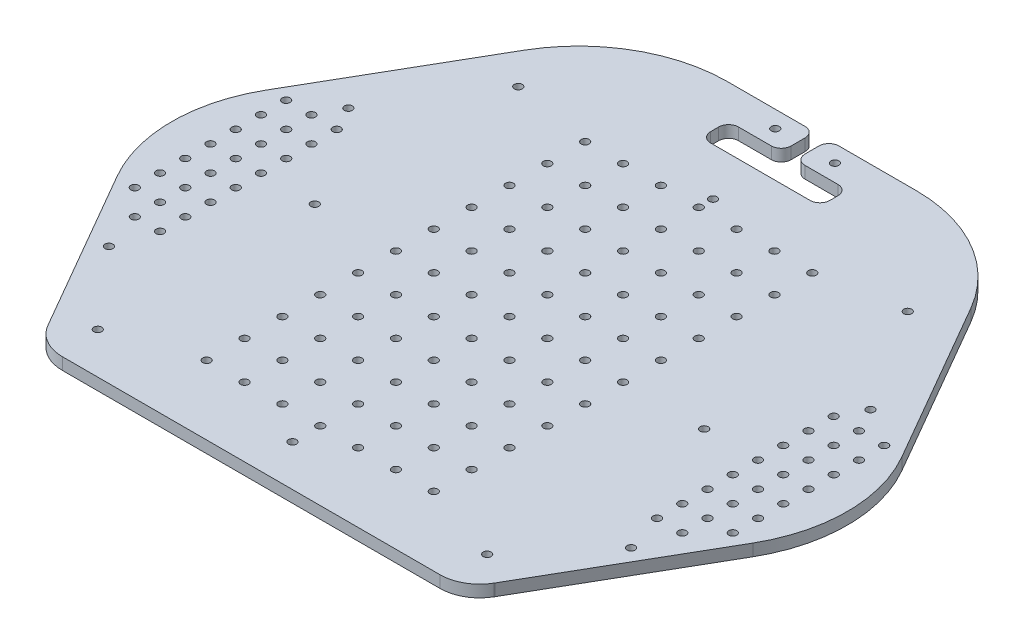
from build123d import *

# Parameters (mm, degrees)
ESBO_O1_R                = 2
RESSALTO_EXTRUS_O1_DEPTH = 6


with BuildPart() as part:
    # Esboço1 → Ressalto-extrusão1 (new body)
    with BuildSketch(Plane(origin=(0, 6, 0), x_dir=(1, 0, 0), z_dir=(0, 1, 0))):
        with BuildLine():
            Line((-94.999273038, -130), (94.999273038, -130))
            ThreePointArc((94.999273038, -130), (104.95780768, -127.344382024), (112.27173596, -120.082758778))
            ThreePointArc((112.27173596, -120.082758778), (112.362006236, -119.927693826), (112.451905284, -119.77241336))
            Line((112.451905284, -119.77241336), (159.951905284, -37.5))
            ThreePointArc((159.951905284, -37.5), (170, 0), (159.951905284, 37.5))
            Line((159.951905284, 37.5), (112.451905284, 119.77241336))
            ThreePointArc((112.451905284, 119.77241336), (85, 147.224318643), (47.5, 157.27241336))
            Line((47.5, 157.27241336), (8.5, 157.27241336))
            ThreePointArc((8.5, 157.27241336), (4.964466094, 155.807947265), (3.5, 152.27241336))
            Line((3.5, 152.27241336), (3.5, 145.27241336))
            ThreePointArc((3.5, 145.27241336), (4.964466094, 141.736879454), (8.5, 140.27241336))
            Line((8.5, 140.27241336), (25, 140.27241336))
            ThreePointArc((25, 140.27241336), (28.535533906, 138.807947265), (30, 135.27241336))
            Line((30, 135.27241336), (30, 131.27241336))
            ThreePointArc((30, 131.27241336), (28.535533906, 127.736879454), (25, 126.27241336))
            Line((25, 126.27241336), (-25, 126.27241336))
            ThreePointArc((-25, 126.27241336), (-28.535533906, 127.736879454), (-30, 131.27241336))
            Line((-30, 131.27241336), (-30, 135.27241336))
            ThreePointArc((-30, 135.27241336), (-28.535533906, 138.807947265), (-25, 140.27241336))
            Line((-25, 140.27241336), (-8.5, 140.27241336))
            ThreePointArc((-8.5, 140.27241336), (-4.964466094, 141.736879454), (-3.5, 145.27241336))
            Line((-3.5, 145.27241336), (-3.5, 152.27241336))
            ThreePointArc((-3.5, 152.27241336), (-4.964466094, 155.807947265), (-8.5, 157.27241336))
            Line((-8.5, 157.27241336), (-47.5, 157.27241336))
            ThreePointArc((-47.5, 157.27241336), (-85, 147.224318643), (-112.451905284, 119.77241336))
            Line((-112.451905284, 119.77241336), (-159.951905284, 37.5))
            ThreePointArc((-159.951905284, 37.5), (-170, 0), (-159.951905284, -37.5))
            Line((-159.951905284, -37.5), (-112.451905284, -119.77241336))
            ThreePointArc((-112.451905284, -119.77241336), (-112.362006236, -119.927693826), (-112.27173596, -120.082758778))
            ThreePointArc((-112.27173596, -120.082758778), (-104.95780768, -127.344382024), (-94.999273038, -130))
        make_face()
        with Locations(Location((150.5, -25.4, 0), (0, 0, 90))):
            Circle(ESBO_O1_R, mode=Mode.SUBTRACT)
        with Locations(Location((150.5, -12.7, 0), (0, 0, 90))):
            Circle(ESBO_O1_R, mode=Mode.SUBTRACT)
        with Locations(Location((150.5, 0, 0), (0, 0, 90))):
            Circle(ESBO_O1_R, mode=Mode.SUBTRACT)
        with Locations(Location((150.5, 12.7, 0), (0, 0, 90))):
            Circle(ESBO_O1_R, mode=Mode.SUBTRACT)
        with Locations(Location((150.5, 25.4, 0), (0, 0, 90))):
            Circle(ESBO_O1_R, mode=Mode.SUBTRACT)
        with Locations(Location((-150.5, -25.4, 0), (0, 0, 90))):
            Circle(ESBO_O1_R, mode=Mode.SUBTRACT)
        with Locations(Location((-150.5, -12.7, 0), (0, 0, 90))):
            Circle(ESBO_O1_R, mode=Mode.SUBTRACT)
        with Locations(Location((-150.5, 0, 0), (0, 0, 90))):
            Circle(ESBO_O1_R, mode=Mode.SUBTRACT)
        with Locations(Location((-150.5, 12.7, 0), (0, 0, 90))):
            Circle(ESBO_O1_R, mode=Mode.SUBTRACT)
        with Locations(Location((-150.5, 25.4, 0), (0, 0, 90))):
            Circle(ESBO_O1_R, mode=Mode.SUBTRACT)
        with Locations(Location((150.5, -38.1, 0), (0, 0, 90))):
            Circle(ESBO_O1_R, mode=Mode.SUBTRACT)
        with Locations(Location((150.5, 38.1, 0), (0, 0, 90))):
            Circle(ESBO_O1_R, mode=Mode.SUBTRACT)
        with Locations(Location((-150.5, -38.1, 0), (0, 0, 90))):
            Circle(ESBO_O1_R, mode=Mode.SUBTRACT)
        with Locations(Location((-150.5, 38.1, 0), (0, 0, 90))):
            Circle(ESBO_O1_R, mode=Mode.SUBTRACT)
        with Locations(Location((15, 148.77, 0), (0, 0, 90))):
            Circle(ESBO_O1_R, mode=Mode.SUBTRACT)
        with Locations(Location((-15, 148.77, 0), (0, 0, 90))):
            Circle(ESBO_O1_R, mode=Mode.SUBTRACT)
        with Locations(Location((131.4, -70.2, 0), (0, 0, 90))):
            Circle(ESBO_O1_R, mode=Mode.SUBTRACT)
        with Locations(Location((-131.4, -70.2, 0), (0, 0, 90))):
            Circle(ESBO_O1_R, mode=Mode.SUBTRACT)
        with Locations(Location((131.4, 50.3, 0), (0, 0, 90))):
            Circle(ESBO_O1_R, mode=Mode.SUBTRACT)
        with Locations(Location((-131.4, 50.3, 0), (0, 0, 90))):
            Circle(ESBO_O1_R, mode=Mode.SUBTRACT)
        with Locations(Location((98, -109.22, 0), (0, 0, 90))):
            Circle(ESBO_O1_R, mode=Mode.SUBTRACT)
        with Locations(Location((-125.0696, -50.8, 0), (0, 0, 90))):
            Circle(ESBO_O1_R, mode=Mode.SUBTRACT)
        with Locations(Location((-137.7696, -50.8, 0), (0, 0, 90))):
            Circle(ESBO_O1_R, mode=Mode.SUBTRACT)
        with Locations(Location((125.0696, -50.8, 0), (0, 0, 90))):
            Circle(ESBO_O1_R, mode=Mode.SUBTRACT)
        with Locations(Location((137.7696, -50.8, 0), (0, 0, 90))):
            Circle(ESBO_O1_R, mode=Mode.SUBTRACT)
        with Locations(Location((-137.7696, 12.7, 0), (0, 0, 90))):
            Circle(ESBO_O1_R, mode=Mode.SUBTRACT)
        with Locations(Location((-137.7696, 25.4, 0), (0, 0, 90))):
            Circle(ESBO_O1_R, mode=Mode.SUBTRACT)
        with Locations(Location((-137.7696, 38.1, 0), (0, 0, 90))):
            Circle(ESBO_O1_R, mode=Mode.SUBTRACT)
        with Locations(Location((-125.0696, 38.1, 0), (0, 0, 90))):
            Circle(ESBO_O1_R, mode=Mode.SUBTRACT)
        with Locations(Location((-125.0696, 25.4, 0), (0, 0, 90))):
            Circle(ESBO_O1_R, mode=Mode.SUBTRACT)
        with Locations(Location((-125.0696, 12.7, 0), (0, 0, 90))):
            Circle(ESBO_O1_R, mode=Mode.SUBTRACT)
        with Locations(Location((-137.7696, -12.7, 0), (0, 0, 90))):
            Circle(ESBO_O1_R, mode=Mode.SUBTRACT)
        with Locations(Location((-137.7696, -25.4, 0), (0, 0, 90))):
            Circle(ESBO_O1_R, mode=Mode.SUBTRACT)
        with Locations(Location((-137.7696, -38.1, 0), (0, 0, 90))):
            Circle(ESBO_O1_R, mode=Mode.SUBTRACT)
        with Locations(Location((-125.0696, -38.1, 0), (0, 0, 90))):
            Circle(ESBO_O1_R, mode=Mode.SUBTRACT)
        with Locations(Location((-125.0696, -25.4, 0), (0, 0, 90))):
            Circle(ESBO_O1_R, mode=Mode.SUBTRACT)
        with Locations(Location((-125.0696, -12.7, 0), (0, 0, 90))):
            Circle(ESBO_O1_R, mode=Mode.SUBTRACT)
        with Locations(Location((-137.7696, 0, 0), (0, 0, 90))):
            Circle(ESBO_O1_R, mode=Mode.SUBTRACT)
        with Locations(Location((-125.0696, 0, 0), (0, 0, 90))):
            Circle(ESBO_O1_R, mode=Mode.SUBTRACT)
        with Locations(Location((-97.9932, 0, 0), (0, 0, 90))):
            Circle(ESBO_O1_R, mode=Mode.SUBTRACT)
        with Locations(Location((137.7696, 12.7, 0), (0, 0, 90))):
            Circle(ESBO_O1_R, mode=Mode.SUBTRACT)
        with Locations(Location((137.7696, 25.4, 0), (0, 0, 90))):
            Circle(ESBO_O1_R, mode=Mode.SUBTRACT)
        with Locations(Location((137.7696, 38.1, 0), (0, 0, 90))):
            Circle(ESBO_O1_R, mode=Mode.SUBTRACT)
        with Locations(Location((125.0696, 38.1, 0), (0, 0, 90))):
            Circle(ESBO_O1_R, mode=Mode.SUBTRACT)
        with Locations(Location((125.0696, 25.4, 0), (0, 0, 90))):
            Circle(ESBO_O1_R, mode=Mode.SUBTRACT)
        with Locations(Location((125.0696, 12.7, 0), (0, 0, 90))):
            Circle(ESBO_O1_R, mode=Mode.SUBTRACT)
        with Locations(Location((137.7696, -12.7, 0), (0, 0, 90))):
            Circle(ESBO_O1_R, mode=Mode.SUBTRACT)
        with Locations(Location((137.7696, -25.4, 0), (0, 0, 90))):
            Circle(ESBO_O1_R, mode=Mode.SUBTRACT)
        with Locations(Location((137.7696, -38.1, 0), (0, 0, 90))):
            Circle(ESBO_O1_R, mode=Mode.SUBTRACT)
        with Locations(Location((125.0696, -38.1, 0), (0, 0, 90))):
            Circle(ESBO_O1_R, mode=Mode.SUBTRACT)
        with Locations(Location((125.0696, -25.4, 0), (0, 0, 90))):
            Circle(ESBO_O1_R, mode=Mode.SUBTRACT)
        with Locations(Location((125.0696, -12.7, 0), (0, 0, 90))):
            Circle(ESBO_O1_R, mode=Mode.SUBTRACT)
        with Locations(Location((137.7696, 0, 0), (0, 0, 90))):
            Circle(ESBO_O1_R, mode=Mode.SUBTRACT)
        with Locations(Location((125.0696, 0, 0), (0, 0, 90))):
            Circle(ESBO_O1_R, mode=Mode.SUBTRACT)
        with Locations(Location((97.9932, 0, 0), (0, 0, 90))):
            Circle(ESBO_O1_R, mode=Mode.SUBTRACT)
        with Locations(Location((57.15, -95.25, 0), (0, 0, 90))):
            Circle(ESBO_O1_R, mode=Mode.SUBTRACT)
        with Locations(Location((38.1, -95.25, 0), (0, 0, 90))):
            Circle(ESBO_O1_R, mode=Mode.SUBTRACT)
        with Locations(Location((19.05, -95.25, 0), (0, 0, 90))):
            Circle(ESBO_O1_R, mode=Mode.SUBTRACT)
        with Locations(Location((0, -95.25, 0), (0, 0, 90))):
            Circle(ESBO_O1_R, mode=Mode.SUBTRACT)
        with Locations(Location((-19.05, -95.25, 0), (0, 0, 90))):
            Circle(ESBO_O1_R, mode=Mode.SUBTRACT)
        with Locations(Location((-38.1, -95.25, 0), (0, 0, 90))):
            Circle(ESBO_O1_R, mode=Mode.SUBTRACT)
        with Locations(Location((-57.15, -95.25, 0), (0, 0, 90))):
            Circle(ESBO_O1_R, mode=Mode.SUBTRACT)
        with Locations(Location((-57.15, 95.25, 0), (0, 0, 90))):
            Circle(ESBO_O1_R, mode=Mode.SUBTRACT)
        with Locations(Location((-38.1, 95.25, 0), (0, 0, 90))):
            Circle(ESBO_O1_R, mode=Mode.SUBTRACT)
        with Locations(Location((-19.05, 95.25, 0), (0, 0, 90))):
            Circle(ESBO_O1_R, mode=Mode.SUBTRACT)
        with Locations(Location((0, 95.25, 0), (0, 0, 90))):
            Circle(ESBO_O1_R, mode=Mode.SUBTRACT)
        with Locations(Location((19.05, 95.25, 0), (0, 0, 90))):
            Circle(ESBO_O1_R, mode=Mode.SUBTRACT)
        with Locations(Location((38.1, 95.25, 0), (0, 0, 90))):
            Circle(ESBO_O1_R, mode=Mode.SUBTRACT)
        with Locations(Location((57.15, 95.25, 0), (0, 0, 90))):
            Circle(ESBO_O1_R, mode=Mode.SUBTRACT)
        with Locations(Location((57.15, -76.2, 0), (0, 0, 90))):
            Circle(ESBO_O1_R, mode=Mode.SUBTRACT)
        with Locations(Location((38.1, -76.2, 0), (0, 0, 90))):
            Circle(ESBO_O1_R, mode=Mode.SUBTRACT)
        with Locations(Location((19.05, -76.2, 0), (0, 0, 90))):
            Circle(ESBO_O1_R, mode=Mode.SUBTRACT)
        with Locations(Location((0, -76.2, 0), (0, 0, 90))):
            Circle(ESBO_O1_R, mode=Mode.SUBTRACT)
        with Locations(Location((-19.05, -76.2, 0), (0, 0, 90))):
            Circle(ESBO_O1_R, mode=Mode.SUBTRACT)
        with Locations(Location((-38.1, -76.2, 0), (0, 0, 90))):
            Circle(ESBO_O1_R, mode=Mode.SUBTRACT)
        with Locations(Location((-57.15, -76.2, 0), (0, 0, 90))):
            Circle(ESBO_O1_R, mode=Mode.SUBTRACT)
        with Locations(Location((-57.15, 76.2, 0), (0, 0, 90))):
            Circle(ESBO_O1_R, mode=Mode.SUBTRACT)
        with Locations(Location((-38.1, 76.2, 0), (0, 0, 90))):
            Circle(ESBO_O1_R, mode=Mode.SUBTRACT)
        with Locations(Location((-19.05, 76.2, 0), (0, 0, 90))):
            Circle(ESBO_O1_R, mode=Mode.SUBTRACT)
        with Locations(Location((0, 76.2, 0), (0, 0, 90))):
            Circle(ESBO_O1_R, mode=Mode.SUBTRACT)
        with Locations(Location((19.05, 76.2, 0), (0, 0, 90))):
            Circle(ESBO_O1_R, mode=Mode.SUBTRACT)
        with Locations(Location((38.1, 76.2, 0), (0, 0, 90))):
            Circle(ESBO_O1_R, mode=Mode.SUBTRACT)
        with Locations(Location((57.15, 76.2, 0), (0, 0, 90))):
            Circle(ESBO_O1_R, mode=Mode.SUBTRACT)
        with Locations(Location((57.15, -57.15, 0), (0, 0, 90))):
            Circle(ESBO_O1_R, mode=Mode.SUBTRACT)
        with Locations(Location((38.1, -57.15, 0), (0, 0, 90))):
            Circle(ESBO_O1_R, mode=Mode.SUBTRACT)
        with Locations(Location((19.05, -57.15, 0), (0, 0, 90))):
            Circle(ESBO_O1_R, mode=Mode.SUBTRACT)
        with Locations(Location((0, -57.15, 0), (0, 0, 90))):
            Circle(ESBO_O1_R, mode=Mode.SUBTRACT)
        with Locations(Location((-19.05, -57.15, 0), (0, 0, 90))):
            Circle(ESBO_O1_R, mode=Mode.SUBTRACT)
        with Locations(Location((-38.1, -57.15, 0), (0, 0, 90))):
            Circle(ESBO_O1_R, mode=Mode.SUBTRACT)
        with Locations(Location((-57.15, -57.15, 0), (0, 0, 90))):
            Circle(ESBO_O1_R, mode=Mode.SUBTRACT)
        with Locations(Location((-57.15, -38.1, 0), (0, 0, 90))):
            Circle(ESBO_O1_R, mode=Mode.SUBTRACT)
        with Locations(Location((-57.15, -19.05, 0), (0, 0, 90))):
            Circle(ESBO_O1_R, mode=Mode.SUBTRACT)
        with Locations(Location((-57.15, 0, 0), (0, 0, 90))):
            Circle(ESBO_O1_R, mode=Mode.SUBTRACT)
        with Locations(Location((-57.15, 19.05, 0), (0, 0, 90))):
            Circle(ESBO_O1_R, mode=Mode.SUBTRACT)
        with Locations(Location((-57.15, 38.1, 0), (0, 0, 90))):
            Circle(ESBO_O1_R, mode=Mode.SUBTRACT)
        with Locations(Location((-57.15, 57.15, 0), (0, 0, 90))):
            Circle(ESBO_O1_R, mode=Mode.SUBTRACT)
        with Locations(Location((-38.1, 57.15, 0), (0, 0, 90))):
            Circle(ESBO_O1_R, mode=Mode.SUBTRACT)
        with Locations(Location((-19.05, 57.15, 0), (0, 0, 90))):
            Circle(ESBO_O1_R, mode=Mode.SUBTRACT)
        with Locations(Location((0, 57.15, 0), (0, 0, 90))):
            Circle(ESBO_O1_R, mode=Mode.SUBTRACT)
        with Locations(Location((19.05, 57.15, 0), (0, 0, 90))):
            Circle(ESBO_O1_R, mode=Mode.SUBTRACT)
        with Locations(Location((38.1, 57.15, 0), (0, 0, 90))):
            Circle(ESBO_O1_R, mode=Mode.SUBTRACT)
        with Locations(Location((57.15, 57.15, 0), (0, 0, 90))):
            Circle(ESBO_O1_R, mode=Mode.SUBTRACT)
        with Locations(Location((57.15, 38.1, 0), (0, 0, 90))):
            Circle(ESBO_O1_R, mode=Mode.SUBTRACT)
        with Locations(Location((57.15, 19.05, 0), (0, 0, 90))):
            Circle(ESBO_O1_R, mode=Mode.SUBTRACT)
        with Locations(Location((57.15, 0, 0), (0, 0, 90))):
            Circle(ESBO_O1_R, mode=Mode.SUBTRACT)
        with Locations(Location((57.15, -19.05, 0), (0, 0, 90))):
            Circle(ESBO_O1_R, mode=Mode.SUBTRACT)
        with Locations(Location((57.15, -38.1, 0), (0, 0, 90))):
            Circle(ESBO_O1_R, mode=Mode.SUBTRACT)
        with Locations(Location((38.1, -38.1, 0), (0, 0, 90))):
            Circle(ESBO_O1_R, mode=Mode.SUBTRACT)
        with Locations(Location((19.05, -38.1, 0), (0, 0, 90))):
            Circle(ESBO_O1_R, mode=Mode.SUBTRACT)
        with Locations(Location((0, -38.1, 0), (0, 0, 90))):
            Circle(ESBO_O1_R, mode=Mode.SUBTRACT)
        with Locations(Location((-19.05, -38.1, 0), (0, 0, 90))):
            Circle(ESBO_O1_R, mode=Mode.SUBTRACT)
        with Locations(Location((-38.1, -38.1, 0), (0, 0, 90))):
            Circle(ESBO_O1_R, mode=Mode.SUBTRACT)
        with Locations(Location((-38.1, -19.05, 0), (0, 0, 90))):
            Circle(ESBO_O1_R, mode=Mode.SUBTRACT)
        with Locations(Location((-38.1, 0, 0), (0, 0, 90))):
            Circle(ESBO_O1_R, mode=Mode.SUBTRACT)
        with Locations(Location((-38.1, 19.05, 0), (0, 0, 90))):
            Circle(ESBO_O1_R, mode=Mode.SUBTRACT)
        with Locations(Location((-38.1, 38.1, 0), (0, 0, 90))):
            Circle(ESBO_O1_R, mode=Mode.SUBTRACT)
        with Locations(Location((-19.05, 38.1, 0), (0, 0, 90))):
            Circle(ESBO_O1_R, mode=Mode.SUBTRACT)
        with Locations(Location((0, 38.1, 0), (0, 0, 90))):
            Circle(ESBO_O1_R, mode=Mode.SUBTRACT)
        with Locations(Location((19.05, 38.1, 0), (0, 0, 90))):
            Circle(ESBO_O1_R, mode=Mode.SUBTRACT)
        with Locations(Location((38.1, 38.1, 0), (0, 0, 90))):
            Circle(ESBO_O1_R, mode=Mode.SUBTRACT)
        with Locations(Location((38.1, 19.05, 0), (0, 0, 90))):
            Circle(ESBO_O1_R, mode=Mode.SUBTRACT)
        with Locations(Location((38.1, 0, 0), (0, 0, 90))):
            Circle(ESBO_O1_R, mode=Mode.SUBTRACT)
        with Locations(Location((38.1, -19.05, 0), (0, 0, 90))):
            Circle(ESBO_O1_R, mode=Mode.SUBTRACT)
        with Locations(Location((19.05, -19.05, 0), (0, 0, 90))):
            Circle(ESBO_O1_R, mode=Mode.SUBTRACT)
        with Locations(Location((0, -19.05, 0), (0, 0, 90))):
            Circle(ESBO_O1_R, mode=Mode.SUBTRACT)
        with Locations(Location((-19.05, -19.05, 0), (0, 0, 90))):
            Circle(ESBO_O1_R, mode=Mode.SUBTRACT)
        with Locations(Location((-19.05, 0, 0), (0, 0, 90))):
            Circle(ESBO_O1_R, mode=Mode.SUBTRACT)
        with Locations(Location((-19.05, 19.05, 0), (0, 0, 90))):
            Circle(ESBO_O1_R, mode=Mode.SUBTRACT)
        with Locations(Location((0, 19.05, 0), (0, 0, 90))):
            Circle(ESBO_O1_R, mode=Mode.SUBTRACT)
        with Locations(Location((19.05, 19.05, 0), (0, 0, 90))):
            Circle(ESBO_O1_R, mode=Mode.SUBTRACT)
        with Locations(Location((19.05, 0, 0), (0, 0, 90))):
            Circle(ESBO_O1_R, mode=Mode.SUBTRACT)
        with Locations(Location((0, 0, 0), (0, 0, 90))):
            Circle(ESBO_O1_R, mode=Mode.SUBTRACT)
        with Locations(Location((0, -109.22, 0), (0, 0, 90))):
            Circle(ESBO_O1_R, mode=Mode.SUBTRACT)
        with Locations(Location((0, 102.4382, 0), (0, 0, 90))):
            Circle(ESBO_O1_R, mode=Mode.SUBTRACT)
        with Locations(Location((-98, 102.4382, 0), (0, 0, 90))):
            Circle(ESBO_O1_R, mode=Mode.SUBTRACT)
        with Locations(Location((98, 102.4382, 0), (0, 0, 90))):
            Circle(ESBO_O1_R, mode=Mode.SUBTRACT)
        with Locations(Location((-98, -109.22, 0), (0, 0, 90))):
            Circle(ESBO_O1_R, mode=Mode.SUBTRACT)
    extrude(amount=-RESSALTO_EXTRUS_O1_DEPTH)


solid = part.part
